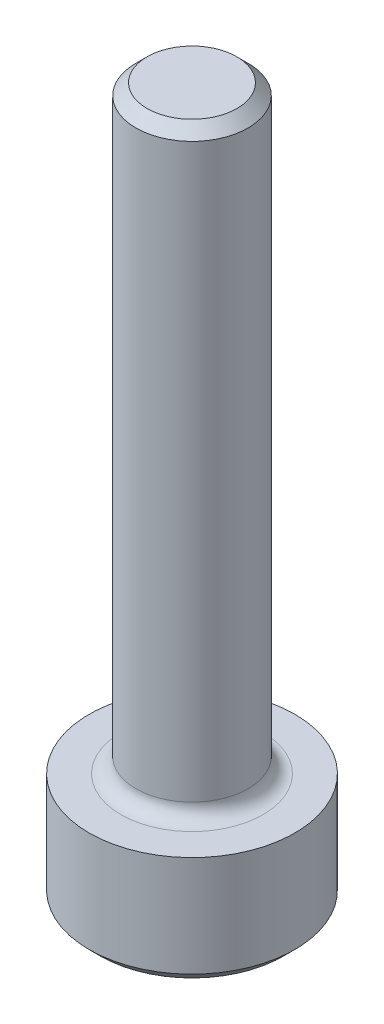
from build123d import *

# Parameters (mm, degrees)
SKETCH2_R           = 1.5
BOSS_EXTRUDE1_DEPTH = 16
SKETCH3_R           = 2.75
BOSS_EXTRUDE2_DEPTH = 3
FILLET1_R           = 0.4
CHAMFER1_SIZE       = 0.3
CUT_EXTRUDE1_DEPTH  = 2.5


with BuildPart() as part:
    # Sketch2 → Boss-Extrude1 (new body)
    with BuildSketch(Plane(origin=(0, 0, 0), x_dir=(1, 0, 0), z_dir=(0, 1, 0))):
        with Locations(Location((0, 0, 0), (0, 0, 270))):
            Circle(SKETCH2_R)
    extrude(amount=BOSS_EXTRUDE1_DEPTH)

    # Sketch3 → Boss-Extrude2 (add)
    with BuildSketch(Plane(origin=(0, 0, 0), x_dir=(1, 0, 0), z_dir=(0, 1, 0))):
        with Locations(Location((0, 0, 0), (0, 0, 270))):
            Circle(SKETCH3_R)
    extrude(amount=-BOSS_EXTRUDE2_DEPTH)

    # Fillet1
    fillet1_edges = [part.edges().sort_by_distance(p)[0] for p in [
        (0, 0, -1.5),
    ]]
    fillet(fillet1_edges, radius=FILLET1_R)

    # Chamfer1
    chamfer1_edges = [part.edges().sort_by_distance(p)[0] for p in [
        (0, 16, -1.5),
        (0, -3, -2.75),
    ]]
    chamfer(chamfer1_edges, length=CHAMFER1_SIZE)

    # Sketch4 → Cut-Extrude1 (cut)
    with BuildSketch(Plane.XZ.offset(3)):
        Polygon((0, 1.443375673), (-1.25, 0.721687836), (-1.25, -0.721687836), (0, -1.443375673), (1.25, -0.721687836), (1.25, 0.721687836), align=None)
    extrude(amount=-CUT_EXTRUDE1_DEPTH, mode=Mode.SUBTRACT)


solid = part.part
